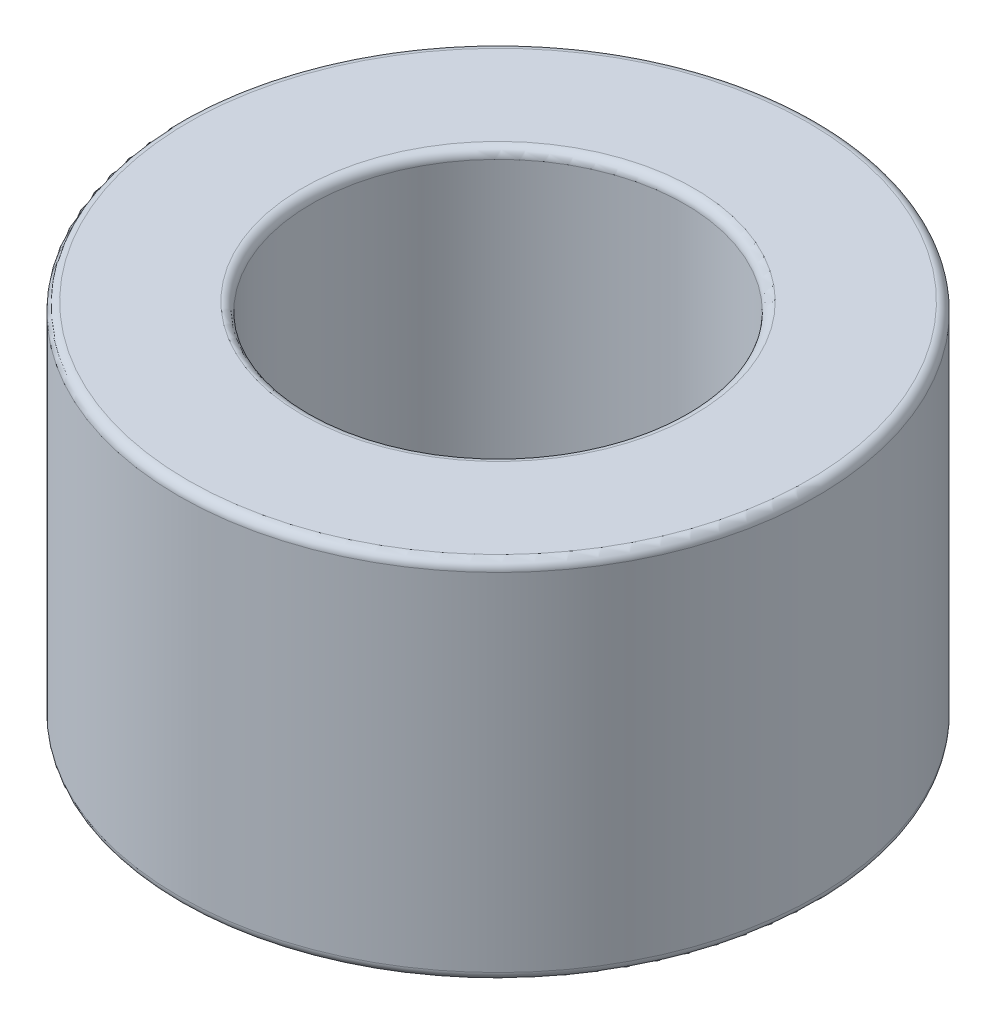
from build123d import *

# Parameters (mm, degrees)
SKETCH1_R           = 3.5
SKETCH1_R_2         = 2.05
BOSS_EXTRUDE1_DEPTH = 4
FILLET1_R           = 0.1


with BuildPart() as part:
    # Sketch1 → Boss-Extrude1 (new body)
    with BuildSketch(Plane(origin=(0, 0, 0), x_dir=(1, 0, 0), z_dir=(0, 1, 0))):
        with Locations(Location((0, 0, 0), (0, 0, 270))):
            Circle(SKETCH1_R)
        with Locations(Location((0, 0, 0), (0, 0, 270))):
            Circle(SKETCH1_R_2, mode=Mode.SUBTRACT)
    extrude(amount=BOSS_EXTRUDE1_DEPTH)

    # Fillet1
    fillet1_edges = [part.edges().sort_by_distance(p)[0] for p in [
        (0, 0, -3.5),
        (0, 4, -3.5),
        (0, 4, -2.05),
    ]]
    fillet(fillet1_edges, radius=FILLET1_R)


solid = part.part
